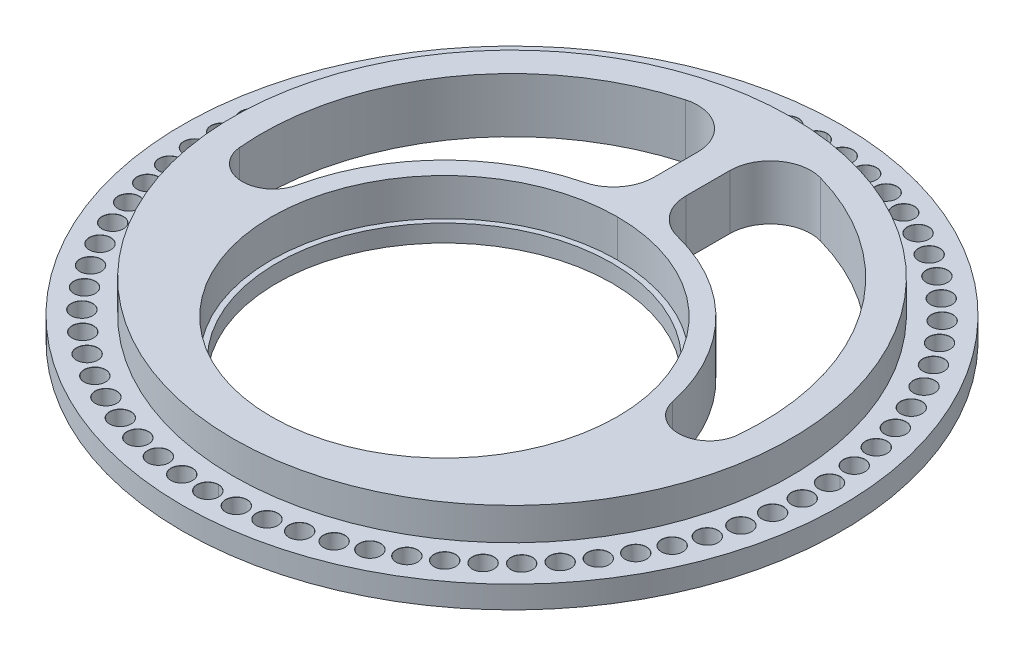
from build123d import *

# Parameters (mm, degrees)
SKETCH1_R                  = 61.9125
SKETCH1_R_2                = 30.988
SLOTTED_BODY_EXTRUDE_DEPTH = 4.191
SKETCH5_R                  = 52.3875
BOSS_EXTRUDE3_DEPTH        = 6.080000032
SKETCH6_R                  = 32.512
CUT_EXTRUDE5_DEPTH         = 89.157862691
SKETCH8_R                  = 32.512
SKETCH8_R_2                = 31.496
BOSS_EXTRUDE4_DEPTH        = 3.255000094
CIRPATTERN1_COUNT          = 70


with BuildPart() as part:
    # Sketch1 → Slotted-Body Extrude (new body)
    with BuildSketch(Plane(origin=(0, 0, 0), x_dir=(1, 0, 0), z_dir=(0, 1, 0))):
        with Locations(Location((0, 0, 0), (0, 0, 270))):
            Circle(SKETCH1_R)
        with Locations(Location((0, -12.7, 0), (0, 0, 270))):
            Circle(SKETCH1_R_2, mode=Mode.SUBTRACT)
    extrude(amount=SLOTTED_BODY_EXTRUDE_DEPTH)

    # Sketch5 → Boss-Extrude3 (add)
    with BuildSketch(Plane(origin=(0, 4.191, 0), x_dir=(1, 0, 0), z_dir=(0, 1, 0))):
        with Locations(Location((0, 0, 0), (0, 0, 270))):
            Circle(SKETCH5_R)
    extrude(amount=BOSS_EXTRUDE3_DEPTH)

    # Sketch6 → Cut-Extrude5 (cut, through all)
    with BuildSketch(Plane.XZ):
        with Locations(Location((0, 12.7, 0), (0, 0, 270))):
            Circle(SKETCH6_R)
        with BuildLine():
            Line((3.013951015, -37.906674687), (3.013951015, -29.674053734))
            ThreePointArc((3.013951015, -29.674053734), (4.62572071, -24.987309811), (8.779192117, -22.283230408))
            ThreePointArc((8.779192117, -22.283230408), (25.925135322, -12.375645206), (35.256203169, 5.09074497))
            ThreePointArc((35.256203169, 5.09074497), (41.313127715, 9.689980346), (46.782976949, 4.406037654))
            ThreePointArc((46.782976949, 4.406037654), (38.737451576, -26.59830719), (12.692135082, -45.243450433))
            ThreePointArc((12.692135082, -45.243450433), (6.03063496, -43.979061474), (3.013951015, -37.906674687))
        make_face()
        with BuildLine():
            Line((-3.013951015, -37.906674687), (-3.013951015, -29.674053734))
            ThreePointArc((-3.013951015, -29.674053734), (-4.62572071, -24.987309811), (-8.779192117, -22.283230408))
            ThreePointArc((-8.779192117, -22.283230408), (-25.925135322, -12.375645206), (-35.256203169, 5.09074497))
            ThreePointArc((-35.256203169, 5.09074497), (-41.313127715, 9.689980346), (-46.782976949, 4.406037654))
            ThreePointArc((-46.782976949, 4.406037654), (-38.737451576, -26.59830719), (-12.692135082, -45.243450433))
            ThreePointArc((-12.692135082, -45.243450433), (-6.03063496, -43.979061474), (-3.013951015, -37.906674687))
        make_face()
    extrude(amount=-CUT_EXTRUDE5_DEPTH, mode=Mode.SUBTRACT)

    # Sketch10 → Ø4.0mm Dowel Hole2 (revolve, cut)
    with BuildSketch(Plane(origin=(0, 4.191, -57.15), x_dir=(0, 0, 1), z_dir=(1, 0, 0))):
        Polygon((0, 0), (0, 4.191), (2, 4.191), (2, 0.025), (2.025, 0), align=None)
    f_4_0mm_dowel_hole2 = revolve(axis=Axis((0, 10.541, -57.15), (0, -1, 0)), mode=Mode.SUBTRACT)

    # CirPattern1: Ø4.0mm Dowel Hole2 ×70 about axis
    cirpattern1_axis = Axis((0, 0, 0), (0, 1, 0))
    for i in range(1, CIRPATTERN1_COUNT):
        add(f_4_0mm_dowel_hole2.rotate(cirpattern1_axis, i * 360 / CIRPATTERN1_COUNT), mode=Mode.SUBTRACT)


with BuildPart() as body_2:
    # Sketch8 → Boss-Extrude4 (new body)
    with BuildSketch(Plane.XZ):
        with Locations(Location((0, 12.7, 0), (0, 0, 270))):
            Circle(SKETCH8_R)
        with Locations(Location((0, 12.7, 0), (0, 0, 270))):
            Circle(SKETCH8_R_2, mode=Mode.SUBTRACT)
    extrude(amount=-BOSS_EXTRUDE4_DEPTH)


solid = Compound([part.part, body_2.part])
